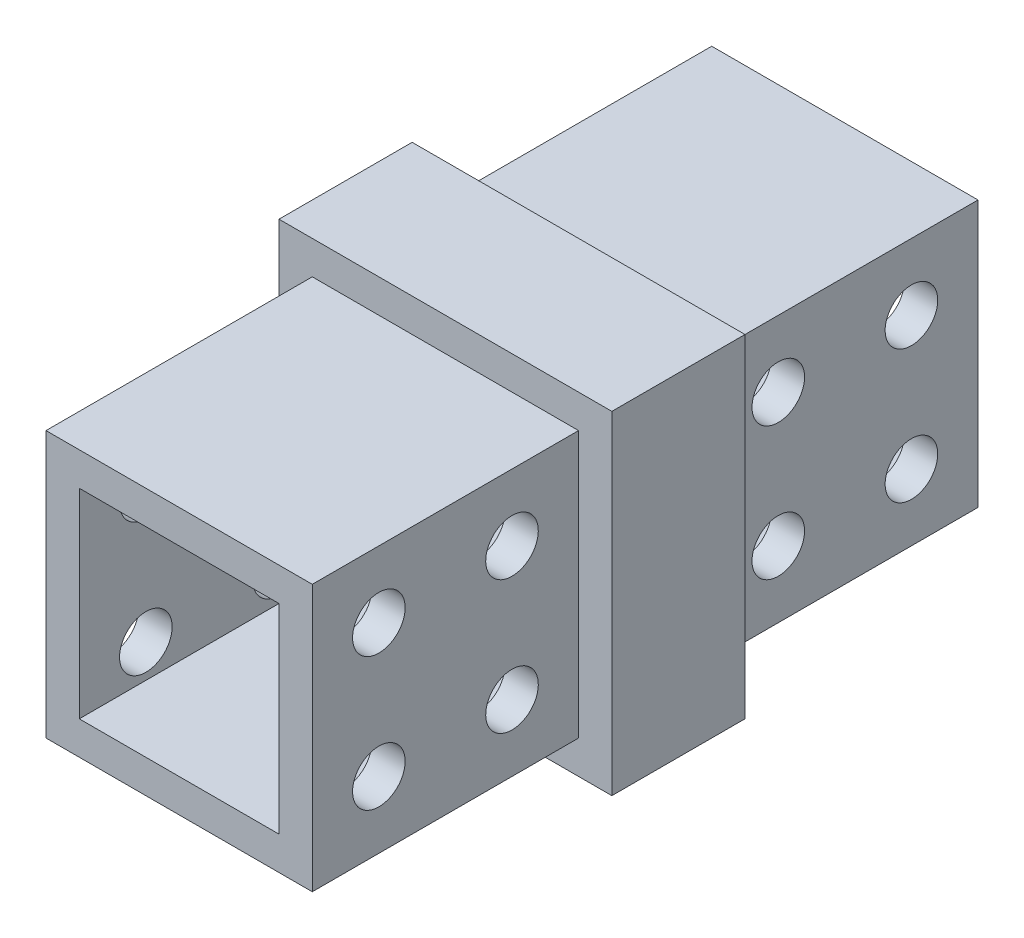
from build123d import *

# Parameters (mm, degrees)
SKETCH1_W           = 25.4
SKETCH1_H           = 25.4
BOSS_EXTRUDE1_DEPTH = 25.4
SKETCH2_W           = 31.75
SKETCH2_H           = 31.75
BOSS_EXTRUDE2_DEPTH = 12.7
SKETCH3_W           = 25.4
SKETCH3_H           = 25.4
BOSS_EXTRUDE3_DEPTH = 25.4
SKETCH4_R           = 2.50825
CUT_EXTRUDE2_DEPTH  = 25.4
SKETCH5_W           = 19.05
SKETCH5_H           = 19.05
CUT_EXTRUDE3_DEPTH  = 63.5


with BuildPart() as part:
    # Sketch1 → Boss-Extrude1 (new body)
    with BuildSketch(Plane.XY):
        with Locations((-12.7, -12.7)):
            Rectangle(SKETCH1_W, SKETCH1_H)
    extrude(amount=BOSS_EXTRUDE1_DEPTH)

    # Sketch2 → Boss-Extrude2 (add)
    with BuildSketch(Plane.XY.offset(25.4)):
        with Locations((-12.7, -12.7)):
            Rectangle(SKETCH2_W, SKETCH2_H)
    extrude(amount=BOSS_EXTRUDE2_DEPTH)

    # Sketch3 → Boss-Extrude3 (add)
    with BuildSketch(Plane.XY.offset(38.1)):
        with Locations((-12.7, -12.7)):
            Rectangle(SKETCH3_W, SKETCH3_H)
    extrude(amount=BOSS_EXTRUDE3_DEPTH)

    # Sketch4 → Cut-Extrude2 (cut)
    with BuildSketch(Plane(origin=(0, 0, 0), x_dir=(0, 0, -1), z_dir=(1, 0, 0))):
        with Locations(Location((-57.15, -6.35, 0), (0, 0, 90))):
            Circle(SKETCH4_R)
        with Locations(Location((-44.45, -6.35, 0), (0, 0, 90))):
            Circle(SKETCH4_R)
        with Locations(Location((-57.15, -19.05, 0), (0, 0, 90))):
            Circle(SKETCH4_R)
        with Locations(Location((-44.45, -19.05, 0), (0, 0, 90))):
            Circle(SKETCH4_R)
    cut_extrude2 = extrude(amount=-CUT_EXTRUDE2_DEPTH, mode=Mode.SUBTRACT)

    # Sketch5 → Cut-Extrude3 (cut)
    with BuildSketch(Plane.XY.offset(63.5)):
        with Locations((-12.7, -12.7)):
            Rectangle(SKETCH5_W, SKETCH5_H)
    extrude(amount=-CUT_EXTRUDE3_DEPTH, mode=Mode.SUBTRACT)

    # Mirror1: Cut-Extrude2 across plane
    add(cut_extrude2.mirror(Plane.XY.offset(31.75)), mode=Mode.SUBTRACT)


solid = part.part
